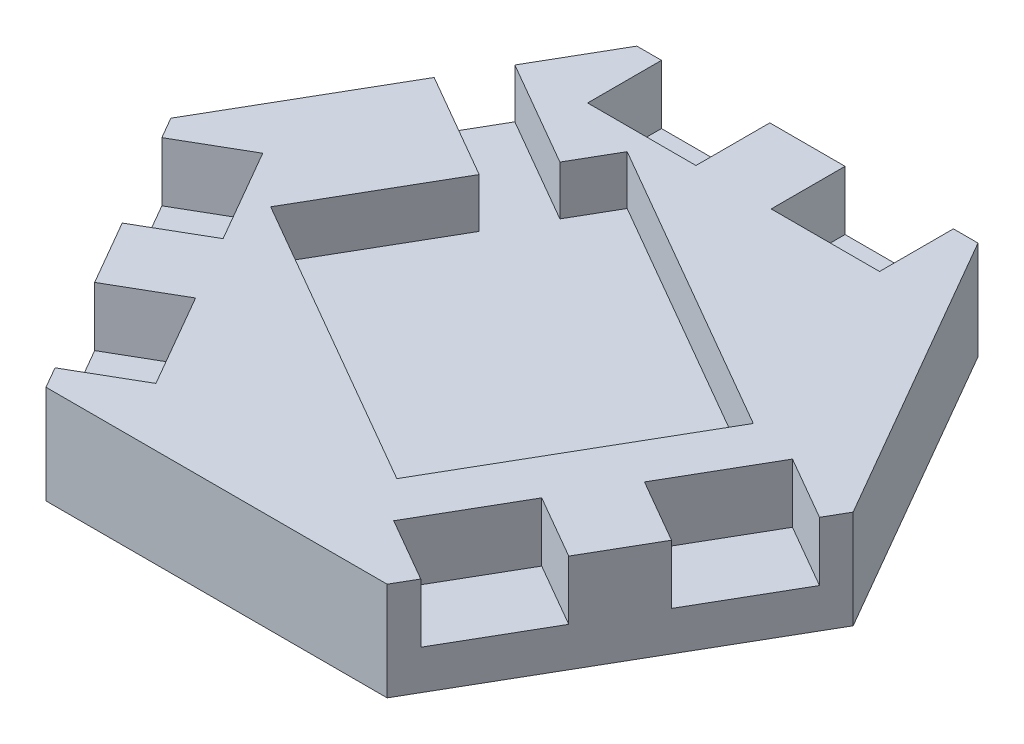
from build123d import *

# Parameters (mm, degrees)
BOSS_EXTRUDE1_DEPTH     = 20
SKETCH2_W               = 22
SKETCH2_H               = 15
CUT_EXTRUDE1_DEPTH      = 12
CUT_EXTRUDE2_DEPTH      = 94.808315196
CUT_EXTRUDE2_DEPTH_BACK = 10


with BuildPart() as part:
    # Sketch1 → Boss-Extrude1 (new body)
    with BuildSketch(Plane(origin=(0, 0, 0), x_dir=(1, 0, 0), z_dir=(0, 1, 0))):
        Polygon((69.282032303, 0), (34.641016151, 60), (-34.641016151, 60), (-69.282032303, 0), (-34.641016151, -60), (34.641016151, -60), align=None)
    extrude(amount=BOSS_EXTRUDE1_DEPTH)

    # Sketch2 → Cut-Extrude1 (cut)
    with BuildSketch(Plane(origin=(0, 20, 0), x_dir=(1, 0, 0), z_dir=(0, 1, 0))):
        with Locations((-18.641016151, 52.5)):
            Rectangle(SKETCH2_W, SKETCH2_H)
        with Locations((18.641016151, 52.5)):
            Rectangle(SKETCH2_W, SKETCH2_H)
        Polygon((66.782032303, -4.330127019), (53.791651246, 3.169872981), (42.791651246, -15.882685902), (55.782032303, -23.382685902), align=None)
        Polygon((48.141016151, -36.617314098), (35.150635095, -29.117314098), (24.150635095, -48.169872981), (37.141016151, -55.669872981), align=None)
        Polygon((-37.141016151, -55.669872981), (-24.150635095, -48.169872981), (-35.150635095, -29.117314098), (-48.141016151, -36.617314098), align=None)
        Polygon((-55.782032303, -23.382685902), (-42.791651246, -15.882685902), (-53.791651246, 3.169872981), (-66.782032303, -4.330127019), align=None)
    extrude(amount=-CUT_EXTRUDE1_DEPTH, mode=Mode.SUBTRACT)

    # Sketch3 → Cut-Extrude2 (cut, two sides: drawn at the far end of the back side and taken through both)
    with BuildSketch(Plane(origin=(0, 20, 0), x_dir=(1, 0, 0), z_dir=(0, 1, 0)).offset(-CUT_EXTRUDE2_DEPTH_BACK)):
        Polygon((-43.560889132, -5.4496732), (17.060889132, -40.4496732), (43.560889132, 5.4496732), (-17.060889132, 40.4496732), align=None)
        Polygon((-22.060889132, 31.789419162), (-28.060889132, 21.397114317), (-49.711524227, 33.897114317), (-43.711524227, 44.289419162), align=None)
    extrude(amount=CUT_EXTRUDE2_DEPTH + CUT_EXTRUDE2_DEPTH_BACK, mode=Mode.SUBTRACT)


solid = part.part
